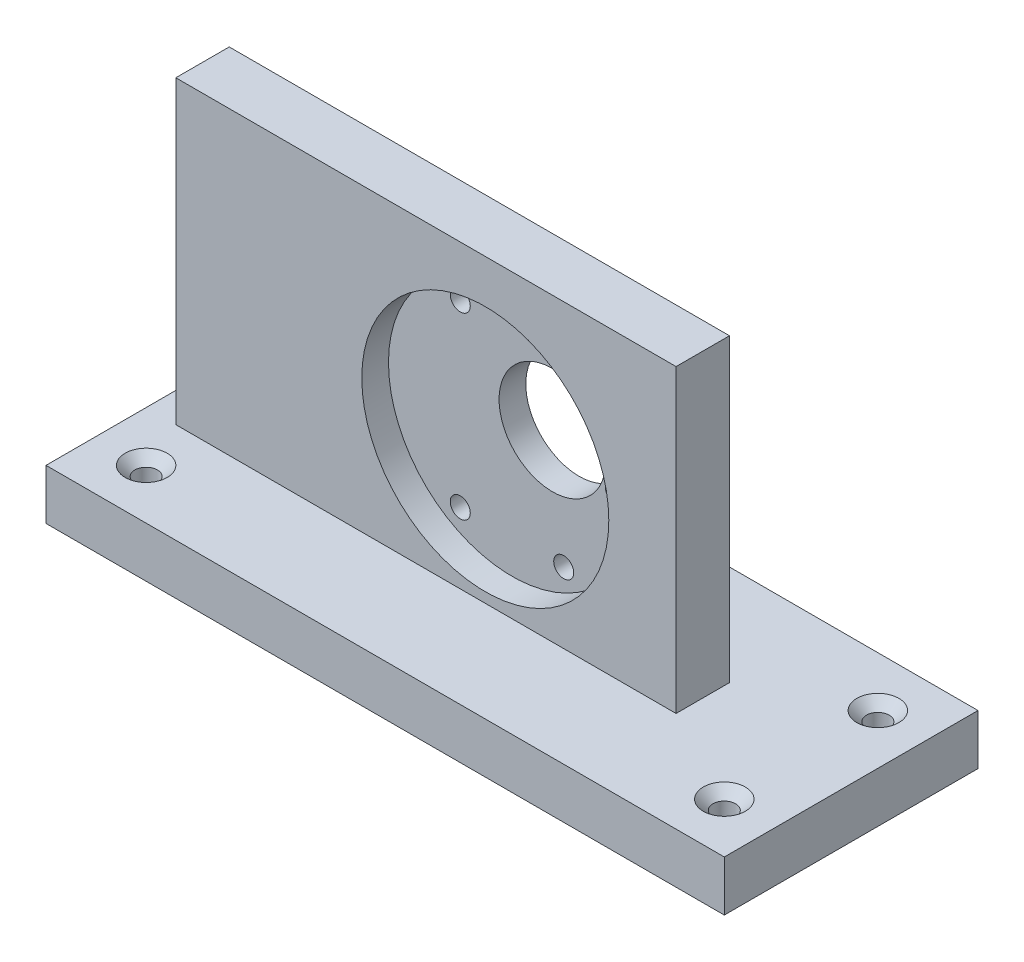
from build123d import *

# Parameters (mm, degrees)
SKETCH3_W                                       = 57.15
SKETCH3_H                                       = 50
BOSS_EXTRUDE1_DEPTH                             = 8
SKETCH3_3_R                                     = 1.5
SKETCH3_3_R_2                                   = 8
CUT_EXTRUDE2_DEPTH                              = 10
SKETCH4_R                                       = 18.5
CUT_EXTRUDE3_DEPTH                              = 4
BOSS_EXTRUDE2_DEPTH                             = 15
BOSS_EXTRUDE2_DEPTH_BACK                        = 23
SKETCH6_W                                       = 101.6
SKETCH6_H                                       = 5
CSK_FOR_M3_FLAT_HEAD_MACHINE_SCREW1_D           = 3.4
CSK_FOR_M3_FLAT_HEAD_MACHINE_SCREW1_CSINK_D     = 6.3
CSK_FOR_M3_FLAT_HEAD_MACHINE_SCREW1_CSINK_ANGLE = 90
CUT_EXTRUDE6_REACH                              = 555.432
SKETCH16_R                                      = 1.7
CUT_EXTRUDE7_REACH                              = 73.656
SKETCH17_W                                      = 25.08228791
SKETCH17_H                                      = 11.980848154
SKETCH18_W                                      = 17.78
SKETCH18_H                                      = 8
BOSS_EXTRUDE3_DEPTH                             = 45
SKETCH13_R                                      = 6.7056
SKETCH13_R_2                                    = 4.8006
BOSS_EXTRUDE4_DEPTH                             = 5.08
CUT_EXTRUDE8_START                              = -5.08
SKETCH19_R                                      = 4.8006
CUT_EXTRUDE8_DEPTH                              = 5.08
BOSS_EXTRUDE5_DEPTH                             = 2.54


with BuildPart() as part:
    # Sketch3 → Boss-Extrude1 (new body)
    with BuildSketch(Plane.XY):
        with Locations((0, 25)):
            Rectangle(SKETCH3_W, SKETCH3_H)
    extrude(amount=BOSS_EXTRUDE1_DEPTH)

    # Sketch3<3> → Cut-Extrude2 (cut)
    with BuildSketch(Plane.XY):
        with Locations(Location((-7.75, 38.423393759, 0), (0, 0, 180))):
            Circle(SKETCH3_3_R)
        with Locations(Location((7.75, 38.423393759, 0), (0, 0, 180))):
            Circle(SKETCH3_3_R)
        with Locations(Location((-7.75, 11.576606241, 0), (0, 0, 180))):
            Circle(SKETCH3_3_R)
        with Locations(Location((7.75, 11.576606241, 0), (0, 0, 180))):
            Circle(SKETCH3_3_R)
        with Locations(Location((15.5, 25, 0), (0, 0, 180))):
            Circle(SKETCH3_3_R)
        with Locations(Location((6.062177825, 28.499999999, 0), (0, 0, 180))):
            Circle(SKETCH3_3_R_2)
    extrude(amount=CUT_EXTRUDE2_DEPTH, mode=Mode.SUBTRACT)

    # Sketch4 → Cut-Extrude3 (cut)
    with BuildSketch(Plane.XY.offset(8)):
        with Locations((0, 25)):
            Circle(SKETCH4_R)
    extrude(amount=-CUT_EXTRUDE3_DEPTH, mode=Mode.SUBTRACT)

    # Sketch6 → Boss-Extrude2 (add, two sides: drawn at the far end of the back side and taken through both)
    with BuildSketch(Plane.XY.offset(8).offset(-BOSS_EXTRUDE2_DEPTH_BACK)):
        with Locations((0, 2.5)):
            Rectangle(SKETCH6_W, SKETCH6_H)
    extrude(amount=BOSS_EXTRUDE2_DEPTH + BOSS_EXTRUDE2_DEPTH_BACK)

    # CSK for M3 Flat Head Machine Screw1 (through all)
    with Locations(Plane(origin=(0, 5, 0), x_dir=(1, 0, 0), z_dir=(0, 1, 0))):
        with Locations((-43.3, 7.5), (-43.3, -15.5), (43.3, -15.5), (43.3, 7.5)):
            CounterSinkHole(CSK_FOR_M3_FLAT_HEAD_MACHINE_SCREW1_D / 2, CSK_FOR_M3_FLAT_HEAD_MACHINE_SCREW1_CSINK_D / 2, counter_sink_angle=CSK_FOR_M3_FLAT_HEAD_MACHINE_SCREW1_CSINK_ANGLE)

    # Sketch16 → Cut-Extrude6 (cut, up to next)
    with BuildSketch(Plane(origin=(-499.248949842, 16.821159134, -28.308871479), x_dir=(0.050830850863696445, -0.0009181581696577921, 0.9987068546806156), z_dir=(0.036090886531912156, 0.9993480899541041, -0.0009181581696584951)), mode=Mode.PRIVATE) as cut_extrude6_sk1:
        with Locations((67.5, 464.499999998)):
            Circle(SKETCH16_R)
    cut_extrude6_tool1 = extrude(cut_extrude6_sk1.sketch, amount=-CUT_EXTRUDE6_REACH, mode=Mode.PRIVATE) & part.part
    # Sketch16 → Cut-Extrude6 (cut, up to next)
    with BuildSketch(Plane(origin=(-499.248949842, 16.821159134, -28.308871479), x_dir=(0.050830850863696445, -0.0009181581696577921, 0.9987068546806156), z_dir=(0.036090886531912156, 0.9993480899541041, -0.0009181581696584951)), mode=Mode.PRIVATE) as cut_extrude6_sk2:
        with Locations((44.5, 464.499999998)):
            Circle(SKETCH16_R)
    cut_extrude6_tool2 = extrude(cut_extrude6_sk2.sketch, amount=-CUT_EXTRUDE6_REACH, mode=Mode.PRIVATE) & part.part
    add(cut_extrude6_tool1.solids().sort_by_distance((-32.221346, -0.005033, 15.492911))[0], mode=Mode.SUBTRACT)
    add(cut_extrude6_tool2.solids().sort_by_distance((-33.390455, 0.016084, -7.477347))[0], mode=Mode.SUBTRACT)

    # Sketch17 → Cut-Extrude7 (cut, up to next)
    with BuildSketch(Plane(origin=(0, 5, 0), x_dir=(1, 0, 0), z_dir=(0, 1, 0)), mode=Mode.PRIVATE) as cut_extrude7_sk1:
        with Locations((-38.258856045, 9.009575923)):
            Rectangle(SKETCH17_W, SKETCH17_H)
    cut_extrude7_tool1 = extrude(cut_extrude7_sk1.sketch, amount=-CUT_EXTRUDE7_REACH, mode=Mode.PRIVATE) & part.part
    add(cut_extrude7_tool1.solids().sort_by_distance((-38.258856, 5, -9.009576))[0], mode=Mode.SUBTRACT)

    # Sketch18 → Boss-Extrude3 (add)
    with BuildSketch(Plane(origin=(0, 5, 0), x_dir=(1, 0, 0), z_dir=(0, 1, 0))):
        with Locations((-37.465, -4)):
            Rectangle(SKETCH18_W, SKETCH18_H)
    extrude(amount=BOSS_EXTRUDE3_DEPTH)

    # Sketch13 → Boss-Extrude4 (add)
    with BuildSketch(Plane(origin=(0, 0, 0), x_dir=(-1, 0, 0), z_dir=(0, 0, -1))):
        with Locations((38.117822207, 28.499999999)):
            Circle(SKETCH13_R)
        with Locations((38.117822207, 28.499999999)):
            Circle(SKETCH13_R_2, mode=Mode.SUBTRACT)
    extrude(amount=BOSS_EXTRUDE4_DEPTH)

    # Sketch19 → Cut-Extrude8 (cut)
    with BuildSketch(Plane(origin=(0, 0, 0), x_dir=(-1, 0, 0), z_dir=(0, 0, -1)).offset(CUT_EXTRUDE8_START)):
        with Locations((38.117822207, 28.499999999)):
            Circle(SKETCH19_R)
    extrude(amount=CUT_EXTRUDE8_DEPTH, mode=Mode.SUBTRACT)

    # Sketch20 → Boss-Extrude5 (add)
    with BuildSketch(Plane.XZ):
        Polygon((-50.8, -3.019151846), (-50.8, 23), (50.8, 23), (50.8, -15), (-25.71771209, -15), (-25.71771209, -3.019151846), align=None)
    extrude(amount=BOSS_EXTRUDE5_DEPTH)


solid = part.part
